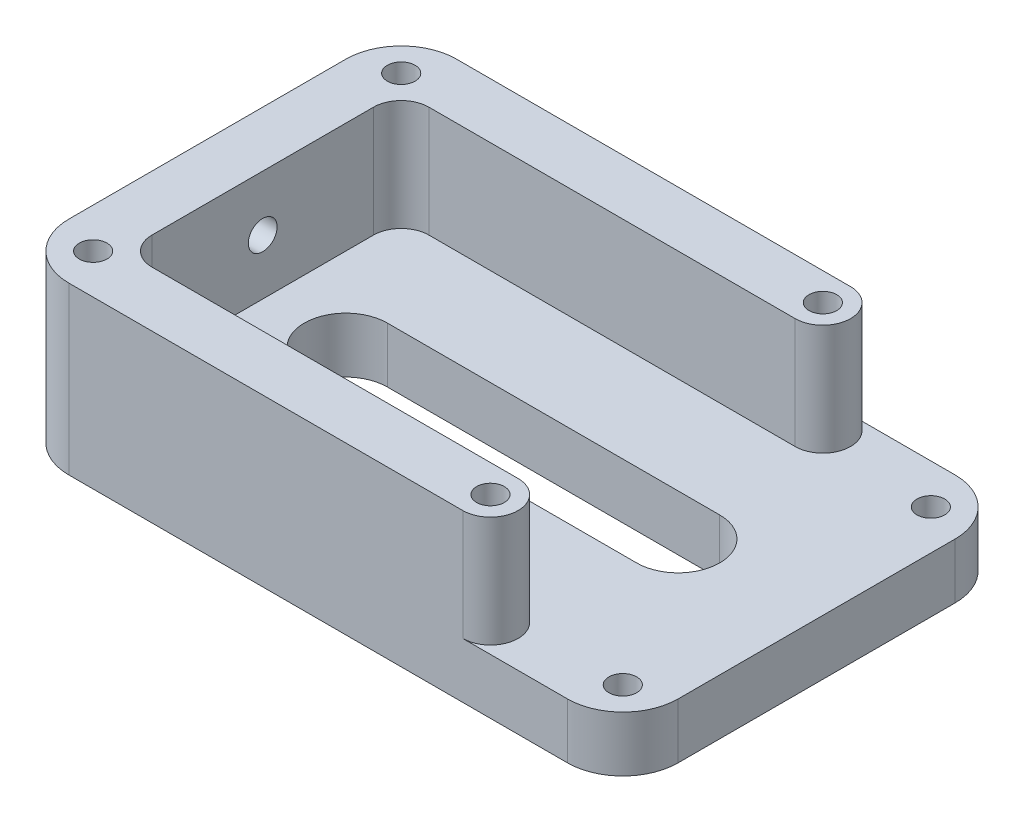
from build123d import *

# Parameters (mm, degrees)
SKETCH1_R           = 2.5
BOSS_EXTRUDE1_DEPTH = 10
BOSS_EXTRUDE2_DEPTH = 30
SKETCH3_R           = 2.5
CUT_EXTRUDE1_DEPTH  = 30
SKETCH6_R           = 2.6
CUT_EXTRUDE3_DEPTH  = 11


with BuildPart() as part:
    # Sketch1 → Boss-Extrude1 (new body)
    with BuildSketch(Plane(origin=(0, 0, 0), x_dir=(1, 0, 0), z_dir=(0, 1, 0))):
        with BuildLine():
            ThreePointArc((-45, 35), (-52.071067812, 32.071067812), (-55, 25))
            Line((-55, 25), (-55, -25))
            ThreePointArc((-55, -25), (-52.071067812, -32.071067812), (-45, -35))
            Line((-45, -35), (45, -35))
            ThreePointArc((45, -35), (52.071067812, -32.071067812), (55, -25))
            Line((55, -25), (55, 25))
            ThreePointArc((55, 25), (52.071067812, 32.071067812), (45, 35))
            Line((45, 35), (-45, 35))
        make_face()
        with BuildLine():
            Line((-30, 7.5), (30, 7.5))
            ThreePointArc((30, 7.5), (37.5, 0), (30, -7.5))
            Line((30, -7.5), (-30, -7.5))
            ThreePointArc((-30, -7.5), (-37.5, 0), (-30, 7.5))
        make_face(mode=Mode.SUBTRACT)
        with Locations((47.803300859, -27.803300859)):
            Circle(SKETCH1_R, mode=Mode.SUBTRACT)
        with Locations((47.803300859, 27.803300859)):
            Circle(SKETCH1_R, mode=Mode.SUBTRACT)
    extrude(amount=BOSS_EXTRUDE1_DEPTH)

    # Sketch1<6> → Boss-Extrude2 (add)
    with BuildSketch(Plane(origin=(0, 0, 0), x_dir=(1, 0, 0), z_dir=(0, 1, 0))):
        with BuildLine():
            Line((26.113792714, 35), (-45, 35))
            ThreePointArc((-45, 35), (-52.071067812, 32.071067812), (-55, 25))
            Line((-55, 25), (-55, -25))
            ThreePointArc((-55, -25), (-52.071067812, -32.071067812), (-45, -35))
            Line((-45, -35), (26.113792684, -35))
            ThreePointArc((26.113792684, -35), (31.113792714, -30.000000008), (26.1137927, -25))
            Line((26.1137927, -25), (-40, -25))
            ThreePointArc((-40, -25), (-43.535533906, -23.535533906), (-45, -20))
            Line((-45, -20), (-45, 20))
            ThreePointArc((-45, 20), (-43.535533906, 23.535533906), (-40, 25))
            Line((-40, 25), (26.113792714, 25))
            ThreePointArc((26.113792714, 25), (31.113792714, 30), (26.113792714, 35))
        make_face()
    extrude(amount=BOSS_EXTRUDE2_DEPTH)

    # Sketch3 → Cut-Extrude1 (cut)
    with BuildSketch(Plane(origin=(0, 30, 0), x_dir=(1, 0, 0), z_dir=(0, 1, 0))):
        with Locations((-47.803300859, 27.803300859)):
            Circle(SKETCH3_R)
        with Locations((-47.803300859, -27.803300859)):
            Circle(SKETCH3_R)
        with Locations((26.113792714, 30)):
            Circle(SKETCH3_R)
        with Locations((26.113792714, -30)):
            Circle(SKETCH3_R)
    extrude(amount=-CUT_EXTRUDE1_DEPTH, mode=Mode.SUBTRACT)

    # Sketch6 → Cut-Extrude3 (cut)
    with BuildSketch(Plane(origin=(-45, 0, 0), x_dir=(0, 0, -1), z_dir=(1, 0, 0))):
        with Locations((0, 20)):
            Circle(SKETCH6_R)
    extrude(amount=-CUT_EXTRUDE3_DEPTH, mode=Mode.SUBTRACT)


solid = part.part
